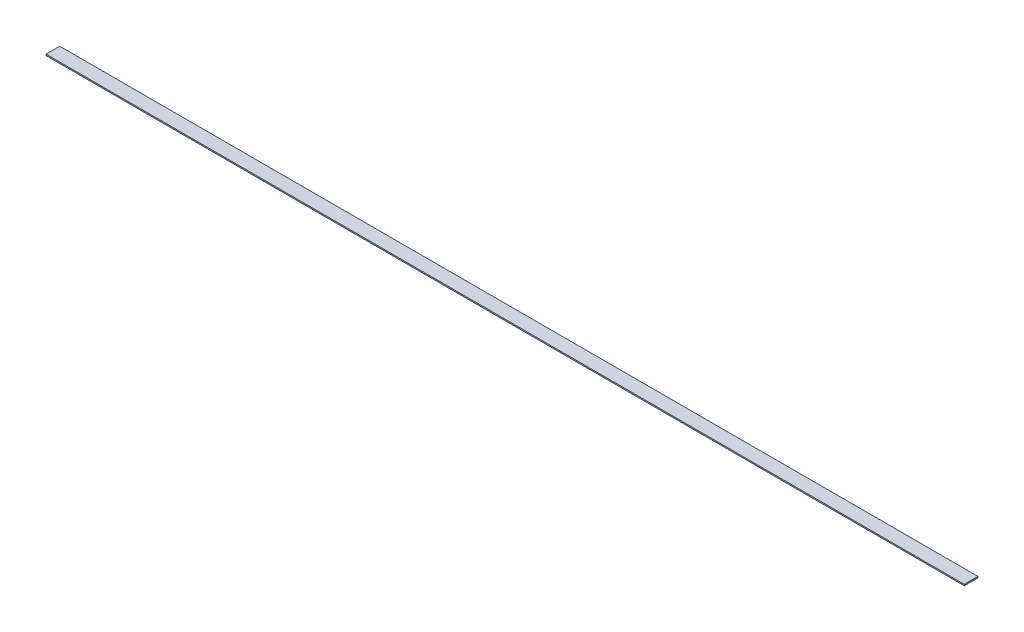
from build123d import *

# Parameters (mm, degrees)
SKETCH1_W           = 3403.6
SKETCH1_H           = 50.8
BOSS_EXTRUDE1_DEPTH = 4.7625


with BuildPart() as part:
    # Sketch1 → Boss-Extrude1 (new body)
    with BuildSketch(Plane(origin=(0, 0, 0), x_dir=(1, 0, 0), z_dir=(0, 1, 0))):
        Rectangle(SKETCH1_W, SKETCH1_H)
    extrude(amount=BOSS_EXTRUDE1_DEPTH)


solid = part.part
